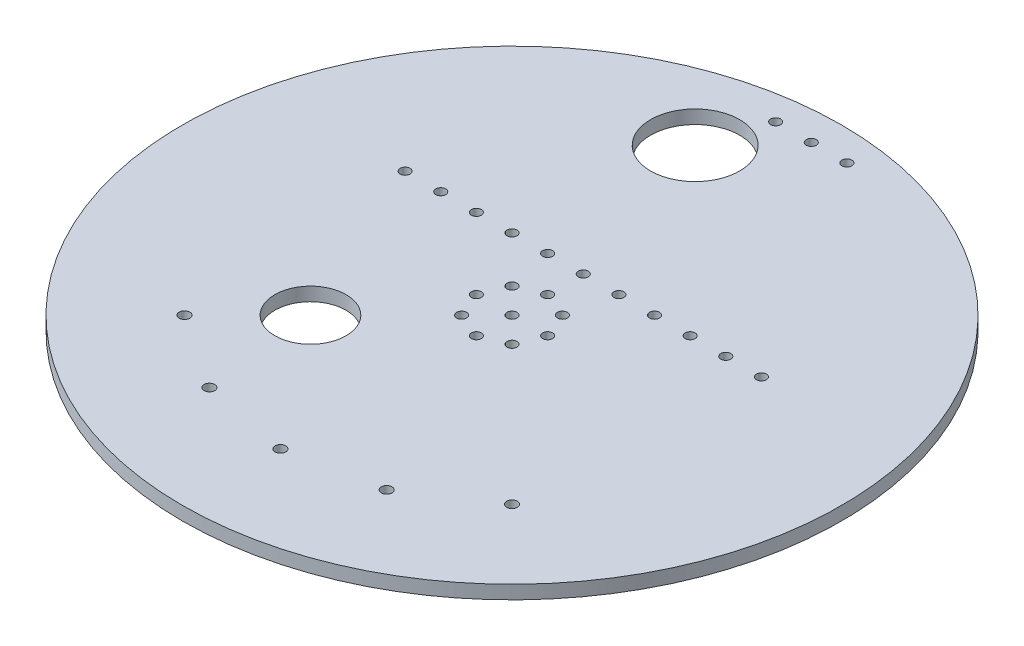
from build123d import *

# Parameters (mm, degrees)
SKETCH1_R           = 117.475
BOSS_EXTRUDE1_DEPTH = 4.826
SKETCH5_R           = 1.778
CUT_EXTRUDE6_DEPTH  = 167.204817999
SKETCH6_R           = 1.778
CUT_EXTRUDE7_DEPTH  = 167.204817999
SKETCH7_R           = 1.778
CUT_EXTRUDE8_DEPTH  = 167.204817999
SKETCH8_R           = 12.7
CUT_EXTRUDE9_DEPTH  = 167.204817999
SKETCH9_R           = 1.905
CUT_EXTRUDE10_DEPTH = 167.204817999
CIRPATTERN1_COUNT   = 3
CIRPATTERN1_ANGLE   = 45
CIRPATTERN2_COUNT   = 3
CIRPATTERN2_ANGLE   = 45
SKETCH10_R          = 15.875
CUT_EXTRUDE11_DEPTH = 167.204817999


with BuildPart() as part:
    # Sketch1 → Boss-Extrude1 (new body)
    with BuildSketch(Plane(origin=(0, 0, 0), x_dir=(1, 0, 0), z_dir=(0, 1, 0))):
        with Locations(Location((0, 0, 0), (0, 0, 270))):
            Circle(SKETCH1_R)
    extrude(amount=-BOSS_EXTRUDE1_DEPTH)

    # Sketch5 → Cut-Extrude6 (cut, through all)
    with BuildSketch(Plane(origin=(0, 0, 0), x_dir=(1, 0, 0), z_dir=(0, 1, 0))):
        with Locations(Location((0, 0, 0), (0, 0, 270))):
            Circle(SKETCH5_R)
    extrude(amount=-CUT_EXTRUDE6_DEPTH, mode=Mode.SUBTRACT)

    # Sketch6 → Cut-Extrude7 (cut, through all)
    with BuildSketch(Plane(origin=(0, 0, 0), x_dir=(1, 0, 0), z_dir=(0, 1, 0))):
        with Locations(Location((0, 25.4, 0), (0, 0, 270))):
            Circle(SKETCH6_R)
        with Locations(Location((-12.7, 25.4, 0), (0, 0, 270))):
            Circle(SKETCH6_R)
        with Locations(Location((-25.4, 25.4, 0), (0, 0, 270))):
            Circle(SKETCH6_R)
        with Locations(Location((-38.1, 25.4, 0), (0, 0, 270))):
            Circle(SKETCH6_R)
        with Locations(Location((12.7, 25.4, 0), (0, 0, 270))):
            Circle(SKETCH6_R)
        with Locations(Location((25.4, 25.4, 0), (0, 0, 270))):
            Circle(SKETCH6_R)
        with Locations(Location((38.1, 25.4, 0), (0, 0, 270))):
            Circle(SKETCH6_R)
        with Locations(Location((-50.8, 25.4, 0), (0, 0, 270))):
            Circle(SKETCH6_R)
        with Locations(Location((50.8, 25.4, 0), (0, 0, 270))):
            Circle(SKETCH6_R)
        with Locations(Location((-63.5, 25.4, 0), (0, 0, 270))):
            Circle(SKETCH6_R)
        with Locations(Location((63.5, 25.4, 0), (0, 0, 270))):
            Circle(SKETCH6_R)
        with Locations(Location((0, 106.68, 0), (0, 0, 270))):
            Circle(SKETCH6_R)
        with Locations(Location((-12.7, 106.68, 0), (0, 0, 270))):
            Circle(SKETCH6_R)
        with Locations(Location((12.7, 106.68, 0), (0, 0, 270))):
            Circle(SKETCH6_R)
    extrude(amount=-CUT_EXTRUDE7_DEPTH, mode=Mode.SUBTRACT)

    # Sketch7 → Cut-Extrude8 (cut, through all)
    with BuildSketch(Plane(origin=(0, 0, 0), x_dir=(1, 0, 0), z_dir=(0, 1, 0))):
        with Locations(Location((0, 12.7, 0), (0, 0, 270))):
            Circle(SKETCH7_R)
        with Locations(Location((12.7, 0, 0), (0, 0, 270))):
            Circle(SKETCH7_R)
        with Locations(Location((0, -12.7, 0), (0, 0, 270))):
            Circle(SKETCH7_R)
        with Locations(Location((-12.7, 0, 0), (0, 0, 270))):
            Circle(SKETCH7_R)
        with Locations(Location((-8.980256121, 8.980256121, 0), (0, 0, 270))):
            Circle(SKETCH7_R)
        with Locations(Location((8.980256121, 8.980256121, 0), (0, 0, 270))):
            Circle(SKETCH7_R)
        with Locations(Location((8.980256121, -8.980256121, 0), (0, 0, 270))):
            Circle(SKETCH7_R)
        with Locations(Location((-8.980256121, -8.980256121, 0), (0, 0, 270))):
            Circle(SKETCH7_R)
    extrude(amount=-CUT_EXTRUDE8_DEPTH, mode=Mode.SUBTRACT)

    # Sketch8 → Cut-Extrude9 (cut, through all)
    with BuildSketch(Plane(origin=(0, 0, 0), x_dir=(1, 0, 0), z_dir=(0, 1, 0))):
        with Locations(Location((-35.921024484, -35.921024484, 0), (0, 0, 270))):
            Circle(SKETCH8_R)
    extrude(amount=-CUT_EXTRUDE9_DEPTH, mode=Mode.SUBTRACT)

    # Sketch9 → Cut-Extrude10 (cut, through all)
    with BuildSketch(Plane(origin=(0, 0, 0), x_dir=(1, 0, 0), z_dir=(0, 1, 0))):
        with Locations(Location((0, -82.55, 0), (0, 0, 270))):
            Circle(SKETCH9_R)
    cut_extrude10 = extrude(amount=-CUT_EXTRUDE10_DEPTH, mode=Mode.SUBTRACT)

    # CirPattern1: Cut-Extrude10 ×3 about axis
    cirpattern1_axis = Axis((0, 0, 0), (0, 1, 0))
    for i in range(1, CIRPATTERN1_COUNT):
        add(cut_extrude10.rotate(cirpattern1_axis, i * CIRPATTERN1_ANGLE / (CIRPATTERN1_COUNT - 1)), mode=Mode.SUBTRACT)

    # CirPattern2: Cut-Extrude10 ×3 about axis
    cirpattern2_axis = Axis((0, 0, 0), (0, -1, 0))
    for i in range(1, CIRPATTERN2_COUNT):
        add(cut_extrude10.rotate(cirpattern2_axis, i * CIRPATTERN2_ANGLE / (CIRPATTERN2_COUNT - 1)), mode=Mode.SUBTRACT)

    # Sketch10 → Cut-Extrude11 (cut, through all)
    with BuildSketch(Plane(origin=(0, 0, 0), x_dir=(1, 0, 0), z_dir=(0, 1, 0))):
        with Locations(Location((-19.812, 85.09, 0), (0, 0, 270))):
            Circle(SKETCH10_R)
    extrude(amount=-CUT_EXTRUDE11_DEPTH, mode=Mode.SUBTRACT)


solid = part.part
